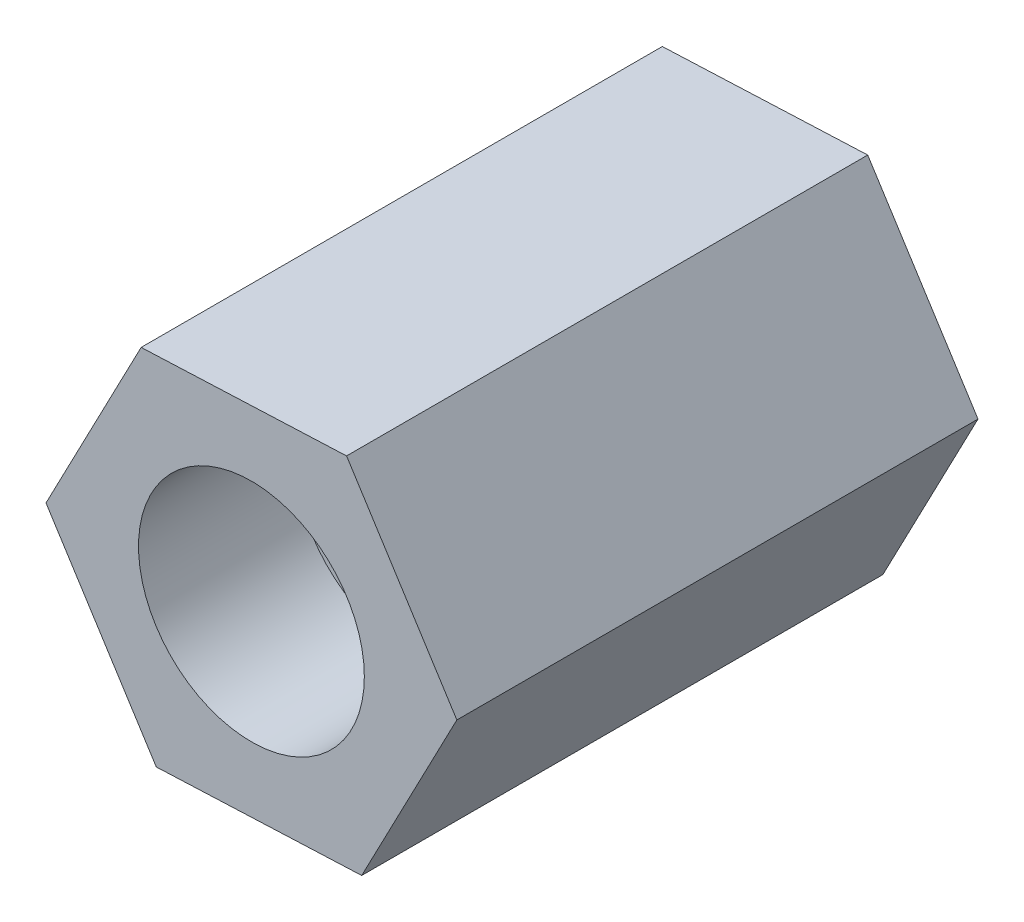
from build123d import *

# Parameters (mm, degrees)
EXTRUDE_1_DEPTH     = 60
SKETCH_2_R          = 13
CUT_EXTRUDE_1_DEPTH = 18
SKETCH_3_R          = 11.1
CUT_EXTRUDE_2_DEPTH = 53.570516706


with BuildPart() as part:
    # 草图1 → 凸台-拉伸1 (new body)
    with BuildSketch(Plane.XY):
        Polygon((-12.695703738, 19.978799762), (-23.65, -1.005402075), (-10.954296262, -20.984201837), (12.695703738, -19.978799762), (23.65, 1.005402075), (10.954296262, 20.984201837), align=None)
    extrude(amount=EXTRUDE_1_DEPTH)

    # 草图2 → 切除-拉伸1 (cut)
    with BuildSketch(Plane.XY.offset(60)):
        Circle(SKETCH_2_R)
    extrude(amount=-CUT_EXTRUDE_1_DEPTH, mode=Mode.SUBTRACT)

    # 草图3 → 切除-拉伸2 (cut, through all)
    with BuildSketch(Plane.XY.offset(42)):
        Circle(SKETCH_3_R)
    extrude(amount=-CUT_EXTRUDE_2_DEPTH, mode=Mode.SUBTRACT)


solid = part.part
